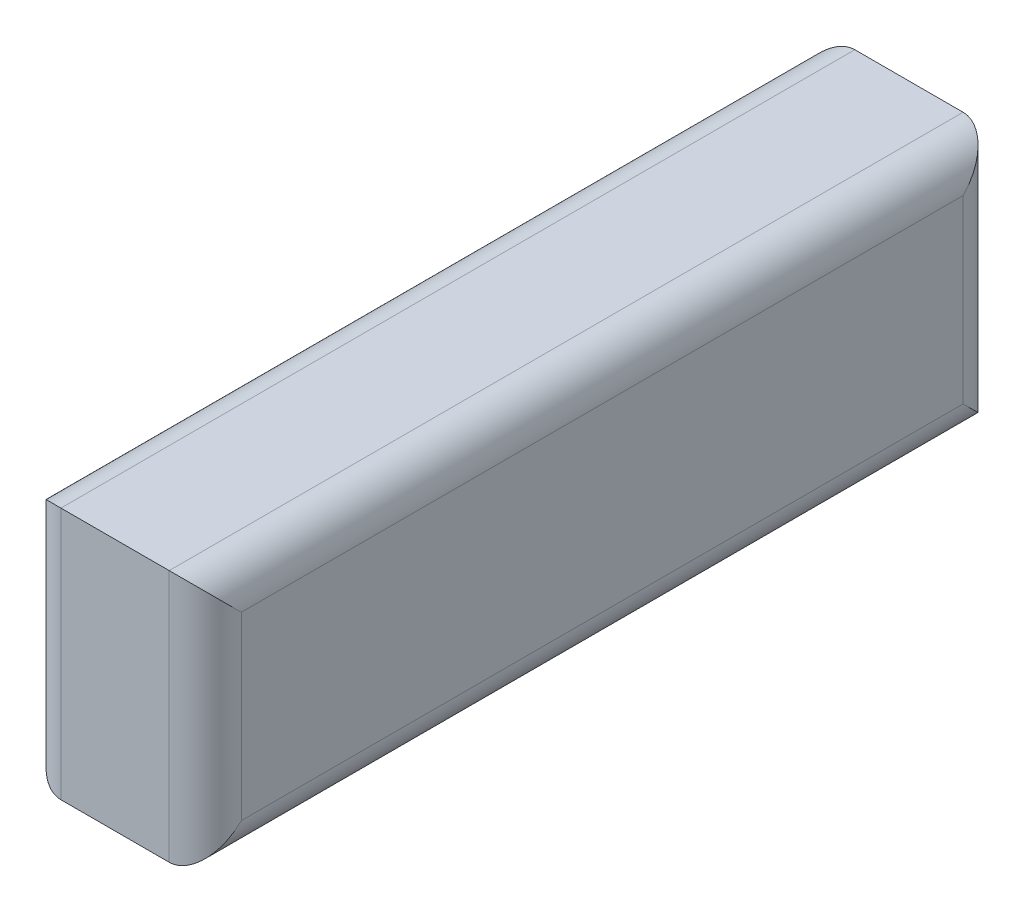
from build123d import *

# Parameters (mm, degrees)
SKETCH1_W           = 25
SKETCH1_H           = 35
BOSS_EXTRUDE1_DEPTH = 110
FILLET1_R           = 5


with BuildPart() as part:
    # Sketch1 → Boss-Extrude1 (new body)
    with BuildSketch(Plane.XY):
        Rectangle(SKETCH1_W, SKETCH1_H)
    extrude(amount=BOSS_EXTRUDE1_DEPTH)

    # Fillet1
    fillet1_edges = [part.edges().sort_by_distance(p)[0] for p in [
        (12.5, 0, 110),
        (-12.5, 0, 110),
        (12.5, 0, 0),
        (-12.5, 0, 0),
        (-12.5, 17.5, 55),
        (12.5, 17.5, 55),
        (12.5, -17.5, 55),
        (-12.5, -17.5, 55),
    ]]
    fillet(fillet1_edges, radius=FILLET1_R)


solid = part.part
